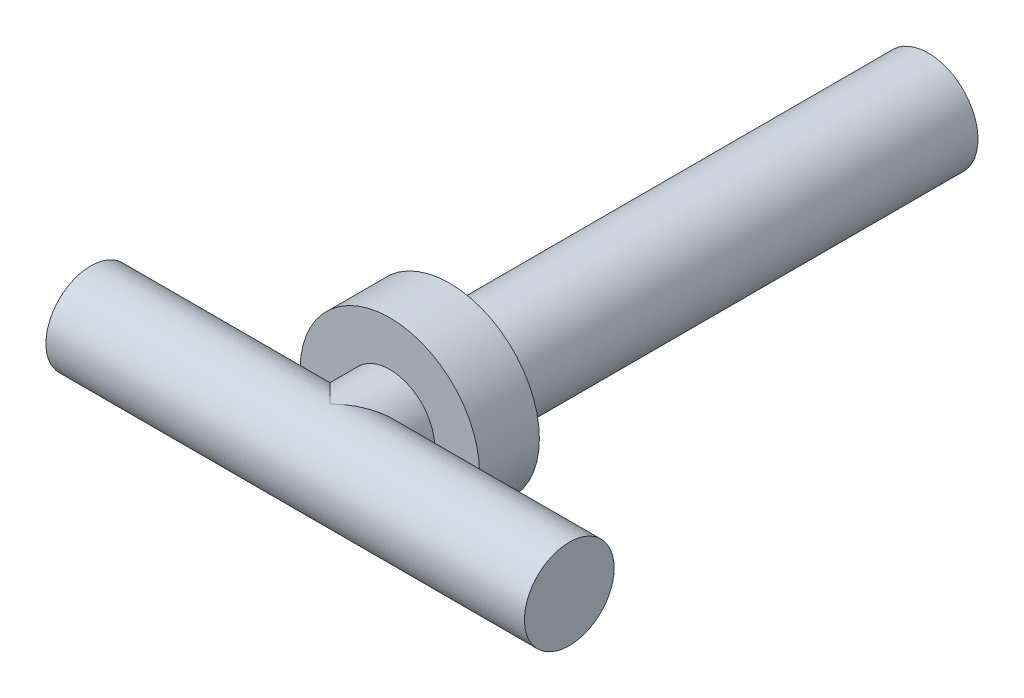
from build123d import *

# Parameters (mm, degrees)
EXTRUDE_START       = -22
EXTRUDE_SKETCH_1_R  = 5
EXTRUDE_1_DEPTH     = 52
EXTRUDE_START_2     = 26
EXTRUDE_SKETCH_2_R  = 9
EXTRUDE_2_DEPTH     = 6
PIPE_SKETCH_1_R     = 4.5
PIPE_1_DEPTH        = 48
PIPE_ROTATE_1_ANGLE = 90
EXTRUDE_START_3     = 30
EXTRUDE_SKETCH_3_R  = 4.5
EXTRUDE_3_DEPTH     = 8


with BuildPart() as part:
    # Extrude sketch 1 → Extrude 1 (new body)
    with BuildSketch(Plane.XY.offset(EXTRUDE_START)):
        Circle(EXTRUDE_SKETCH_1_R)
    extrude(amount=EXTRUDE_1_DEPTH)


with BuildPart() as body_2:
    # Extrude sketch 2 → Extrude 2 (new body)
    with BuildSketch(Plane.XY.offset(EXTRUDE_START_2)):
        Circle(EXTRUDE_SKETCH_2_R)
    extrude(amount=EXTRUDE_2_DEPTH)


with BuildPart() as body_3:
    # Pipe sketch 1 → Pipe 1 (new body)
    with BuildSketch(Plane.XY):
        Circle(PIPE_SKETCH_1_R)
    extrude(amount=PIPE_1_DEPTH)


with BuildPart() as body_3_1:
    # Pipe rotate 1: moved
    add(body_3.part.rotate(Axis((0, 0, 0), (0, 1, 0)), PIPE_ROTATE_1_ANGLE))


with BuildPart() as body_3_2:
    # Pipe place 1: moved
    add(body_3_1.part.moved(Location((-24, 0, 38))))


with BuildPart() as body_4:
    # Extrude sketch 3 → Extrude 3 (new body)
    with BuildSketch(Plane.XY.offset(EXTRUDE_START_3)):
        Circle(EXTRUDE_SKETCH_3_R)
    extrude(amount=EXTRUDE_3_DEPTH)


with BuildPart() as body_3_3:
    add(body_3_2.part)

    # Combine (weld / assembly of features): union body 2, body 4, part
    add(body_2.part)
    add(body_4.part)
    add(part.part)


solid = body_3_3.part
